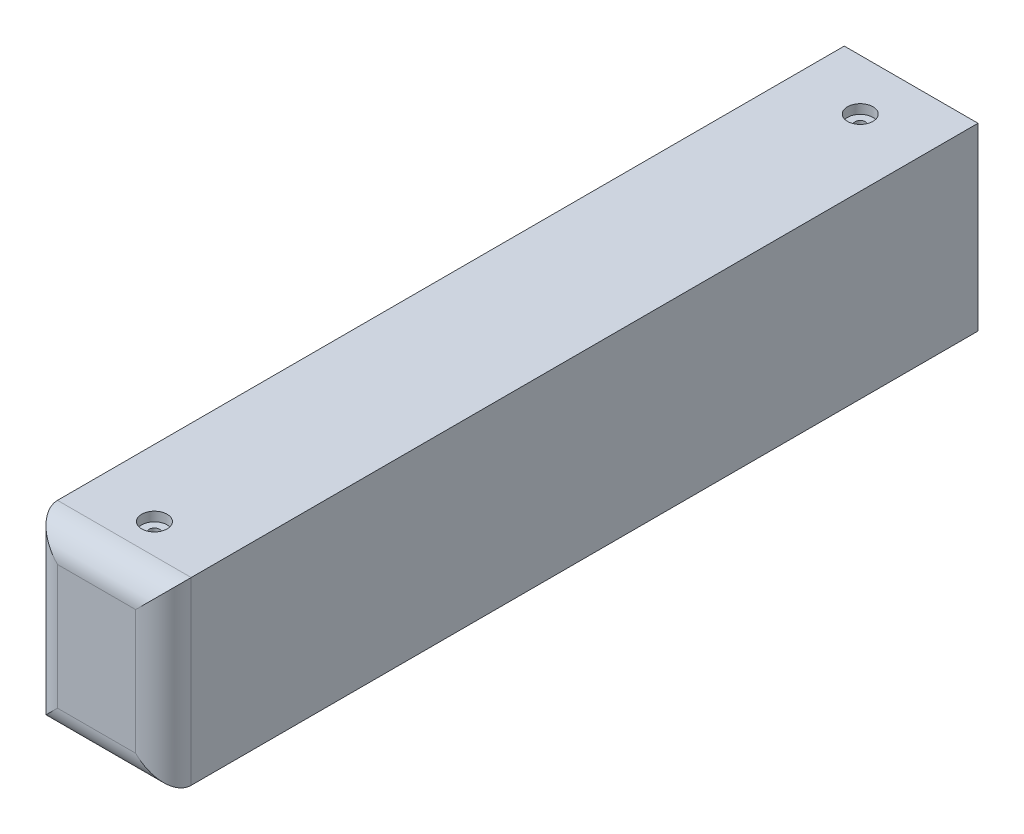
from build123d import *

# Parameters (mm, degrees)
SKIZZE1_W                                           = 115.555555556
SKIZZE1_H                                           = 155.555555556
AUFSATZ_LINEAR_AUSTRAGEN1_DEPTH                     = 704
SCHNITT_LINEAR_AUSTRAGEN1_DEPTH                     = 718.647872662
SCHNITT_LINEAR_AUSTRAGEN2_DEPTH                     = 724.292335414
SPIEGELN2_COPY_1_DEPTH                              = 718.647872662
SPIEGELN2_COPY_2_DEPTH                              = 718.647872662
STIRNSENKUNG_F_R_M8_SENKSCHRAUBE_KOPF_B_D           = 9
STIRNSENKUNG_F_R_M8_SENKSCHRAUBE_KOPF_B_CBORE_D     = 22
STIRNSENKUNG_F_R_M8_SENKSCHRAUBE_KOPF_B_CBORE_DEPTH = 8
STIRNSENKUNG_F_R_M8_SENKSCHRAUBE_KO_2_D             = 9
STIRNSENKUNG_F_R_M8_SENKSCHRAUBE_KO_2_CBORE_D       = 15
STIRNSENKUNG_F_R_M8_SENKSCHRAUBE_KO_2_CBORE_DEPTH   = 8


with BuildPart() as part:
    # Skizze1 → Aufsatz-Linear austragen1 (new body)
    with BuildSketch(Plane.XY):
        Rectangle(SKIZZE1_W, SKIZZE1_H)
    extrude(amount=AUFSATZ_LINEAR_AUSTRAGEN1_DEPTH)

    # Skizze2 → Schnitt-Linear austragen1 (cut, through all)
    with BuildSketch(Plane(origin=(57.777777778, 0, 0), x_dir=(0, 0, -1), z_dir=(1, 0, 0))):
        with BuildLine():
            Line((-704, 53.777777778), (-704, 77.777777778))
            Line((-704, 77.777777778), (-680, 77.777777778))
            ThreePointArc((-680, 77.777777778), (-696.970562748, 70.748340526), (-704, 53.777777778))
        make_face()
    schnitt_linear_austragen1 = extrude(amount=-SCHNITT_LINEAR_AUSTRAGEN1_DEPTH, mode=Mode.SUBTRACT)

    # Skizze3 → Schnitt-Linear austragen2 (cut, through all)
    with BuildSketch(Plane(origin=(0, 77.777777778, 0), x_dir=(1, 0, 0), z_dir=(0, 1, 0))):
        with BuildLine():
            Line((-57.777777778, -680), (-57.777777778, -704))
            Line((-57.777777778, -704), (-33.777777778, -704))
            ThreePointArc((-33.777777778, -704), (-50.748340526, -696.970562748), (-57.777777778, -680))
        make_face()
    schnitt_linear_austragen2 = extrude(amount=-SCHNITT_LINEAR_AUSTRAGEN2_DEPTH, mode=Mode.SUBTRACT)

    # Spiegeln1: Schnitt-Linear austragen1 across plane
    add(schnitt_linear_austragen1.mirror(Plane.ZX), mode=Mode.SUBTRACT)

    # Spiegeln2: Schnitt-Linear austragen2 across plane
    add(schnitt_linear_austragen2.mirror(Plane(origin=(0, 0, 0), x_dir=(0, 0, 1), z_dir=(1, 0, 0))), mode=Mode.SUBTRACT)

    # Spiegeln2 copy 1 sketch → Spiegeln2 copy 1 (cut, through all)
    with BuildSketch(Plane(origin=(-57.777777778, 0, 0), x_dir=(0, 0, -1), z_dir=(-1, 0, 0))):
        with BuildLine():
            Line((-704, 53.777777778), (-704, 77.777777778))
            Line((-704, 77.777777778), (-680, 77.777777778))
            ThreePointArc((-680, 77.777777778), (-696.970562748, 70.748340526), (-704, 53.777777778))
        make_face()
    extrude(amount=-SPIEGELN2_COPY_1_DEPTH, mode=Mode.SUBTRACT)

    # Spiegeln2 copy 2 sketch → Spiegeln2 copy 2 (cut, through all)
    with BuildSketch(Plane(origin=(-57.777777778, 0, 0), x_dir=(0, 0, -1), z_dir=(-1, 0, 0))):
        with BuildLine():
            Line((-704, -53.777777778), (-704, -77.777777778))
            Line((-704, -77.777777778), (-680, -77.777777778))
            ThreePointArc((-680, -77.777777778), (-696.970562748, -70.748340526), (-704, -53.777777778))
        make_face()
    extrude(amount=-SPIEGELN2_COPY_2_DEPTH, mode=Mode.SUBTRACT)

    # Stirnsenkung f_r M8 Senkschraube _Kopf B (through all)
    with Locations(Plane(origin=(0, 77.777777778, 0), x_dir=(1, 0, 0), z_dir=(0, 1, 0))):
        with Locations((0, -654), (0, -44)):
            CounterBoreHole(STIRNSENKUNG_F_R_M8_SENKSCHRAUBE_KOPF_B_D / 2, STIRNSENKUNG_F_R_M8_SENKSCHRAUBE_KOPF_B_CBORE_D / 2, STIRNSENKUNG_F_R_M8_SENKSCHRAUBE_KOPF_B_CBORE_DEPTH)

    # Stirnsenkung f_r M8 Senkschraube _Ko 2 (through all)
    with Locations(Plane(origin=(0, -77.777777778, 0), x_dir=(-1, 0, 0), z_dir=(0, -1, 0))):
        with Locations((0, -654), (0, -44)):
            CounterBoreHole(STIRNSENKUNG_F_R_M8_SENKSCHRAUBE_KO_2_D / 2, STIRNSENKUNG_F_R_M8_SENKSCHRAUBE_KO_2_CBORE_D / 2, STIRNSENKUNG_F_R_M8_SENKSCHRAUBE_KO_2_CBORE_DEPTH)


solid = part.part
